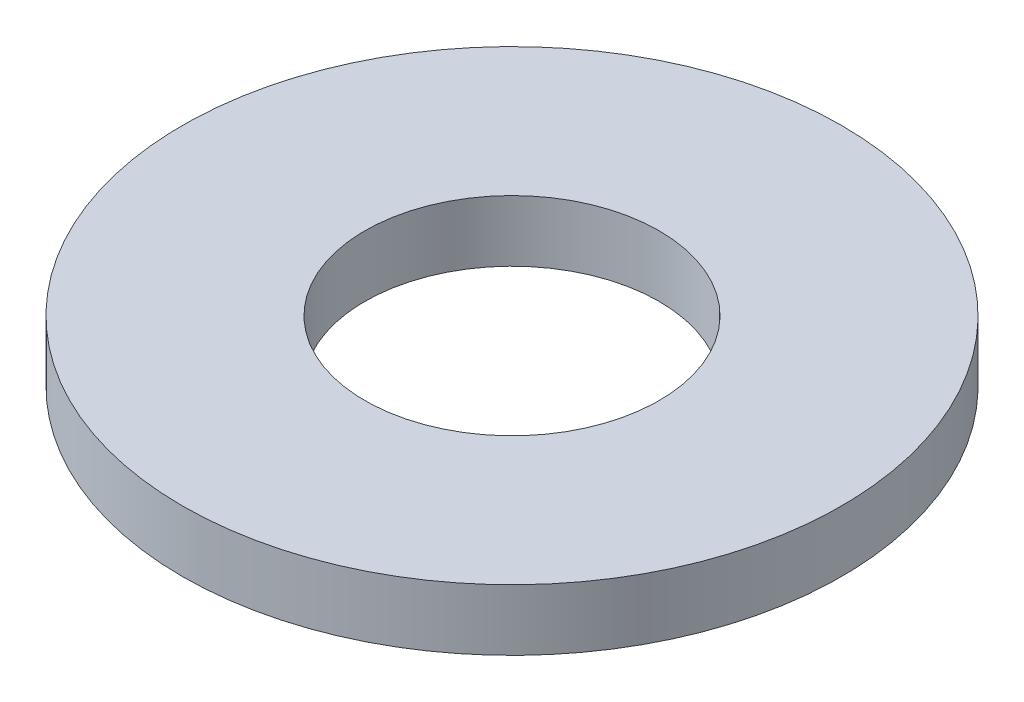
from build123d import *

# Parameters (mm, degrees)
SKETCH1_R           = 8.89
SKETCH1_R_2         = 3.96875
BOSS_EXTRUDE1_DEPTH = 1.651


with BuildPart() as part:
    # Sketch1 → Boss-Extrude1 (new body)
    with BuildSketch(Plane(origin=(0, 0, 0), x_dir=(1, 0, 0), z_dir=(0, 1, 0))):
        with Locations(Location((0, 0, 0), (0, 0, 90))):
            Circle(SKETCH1_R)
        with Locations(Location((0, 0, 0), (0, 0, 90))):
            Circle(SKETCH1_R_2, mode=Mode.SUBTRACT)
    extrude(amount=BOSS_EXTRUDE1_DEPTH)


solid = part.part
